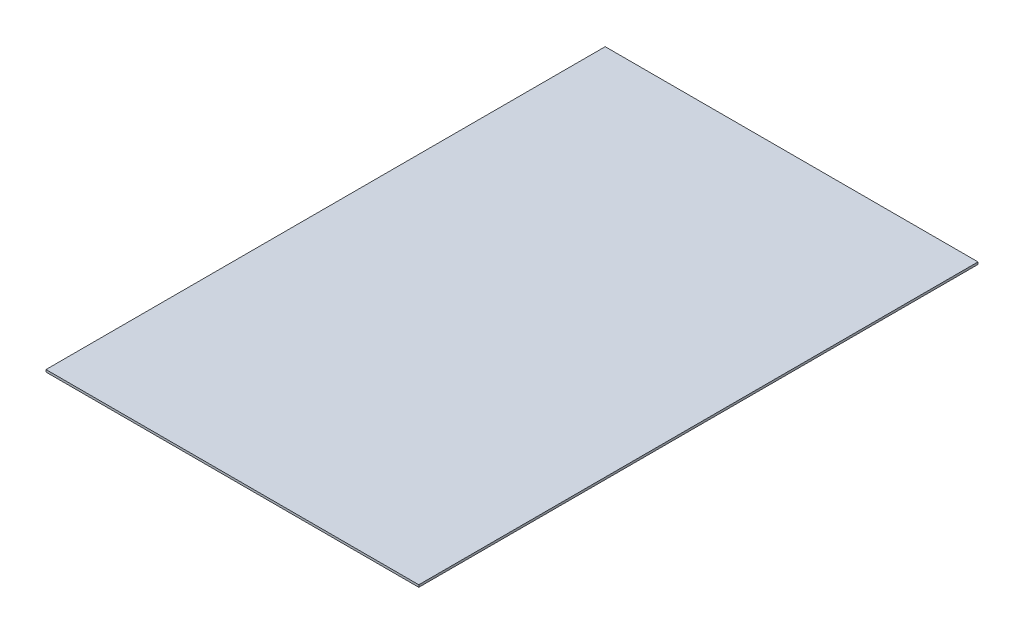
from build123d import *

# Parameters (mm, degrees)
SKETCH1_W           = 5000
SKETCH1_H           = 7500
BOSS_EXTRUDE1_DEPTH = 30


with BuildPart() as part:
    # Sketch1 → Boss-Extrude1 (new body)
    with BuildSketch(Plane(origin=(0, 0, 0), x_dir=(1, 0, 0), z_dir=(0, 1, 0))):
        with Locations((2500, 3750)):
            Rectangle(SKETCH1_W, SKETCH1_H)
    extrude(amount=BOSS_EXTRUDE1_DEPTH)


solid = part.part
